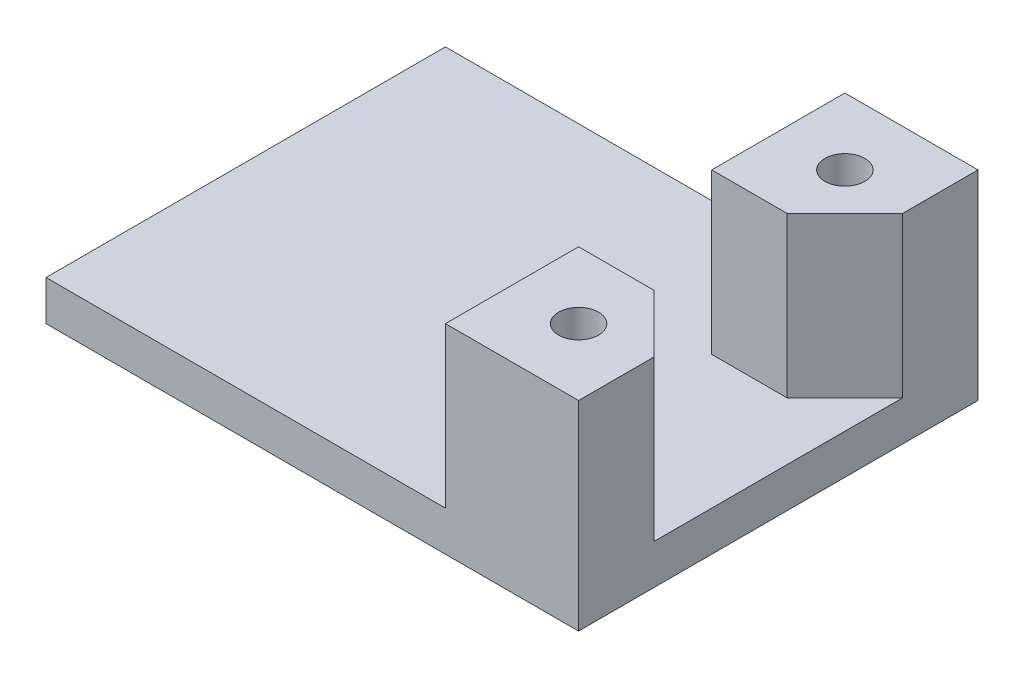
from build123d import *

# Parameters (mm, degrees)
SKETCH1_W           = 40
SKETCH1_H           = 30
SKETCH1_R           = 1.5
BOSS_EXTRUDE1_DEPTH = 15
SKETCH2_W           = 30
SKETCH2_H           = 30
CUT_EXTRUDE1_DEPTH  = 12
SKETCH3_W           = 10
SKETCH3_H           = 10
CUT_EXTRUDE2_DEPTH  = 12
CUT_EXTRUDE3_DEPTH  = 12


with BuildPart() as part:
    # Sketch1 → Boss-Extrude1 (new body)
    with BuildSketch(Plane(origin=(0, 0, 0), x_dir=(1, 0, 0), z_dir=(0, 1, 0))):
        with Locations((-39.556208855, 16.822571299)):
            Rectangle(SKETCH1_W, SKETCH1_H)
        with Locations(Location((-24.556208855, 26.822571299, 0), (0, 0, 270))):
            Circle(SKETCH1_R, mode=Mode.SUBTRACT)
        with Locations(Location((-24.556208855, 6.822571299, 0), (0, 0, 270))):
            Circle(SKETCH1_R, mode=Mode.SUBTRACT)
    extrude(amount=BOSS_EXTRUDE1_DEPTH)

    # Sketch2 → Cut-Extrude1 (cut)
    with BuildSketch(Plane(origin=(0, 15, 0), x_dir=(1, 0, 0), z_dir=(0, 1, 0))):
        with Locations((-44.556208855, 16.822571299)):
            Rectangle(SKETCH2_W, SKETCH2_H)
    extrude(amount=-CUT_EXTRUDE1_DEPTH, mode=Mode.SUBTRACT)

    # Sketch3 → Cut-Extrude2 (cut)
    with BuildSketch(Plane(origin=(0, 15, 0), x_dir=(1, 0, 0), z_dir=(0, 1, 0))):
        with Locations((-24.556208855, 16.822571299)):
            Rectangle(SKETCH3_W, SKETCH3_H)
    extrude(amount=-CUT_EXTRUDE2_DEPTH, mode=Mode.SUBTRACT)

    # Sketch4 → Cut-Extrude3 (cut)
    with BuildSketch(Plane(origin=(0, 15, 0), x_dir=(1, 0, 0), z_dir=(0, 1, 0))):
        Polygon((-23.899354605, 21.822571299), (-19.556208855, 26.165717049), (-19.556208855, 21.822571299), align=None)
        Polygon((-23.899354605, 11.822571299), (-19.556208855, 7.479425548), (-19.556208855, 11.822571299), align=None)
    extrude(amount=-CUT_EXTRUDE3_DEPTH, mode=Mode.SUBTRACT)


solid = part.part
